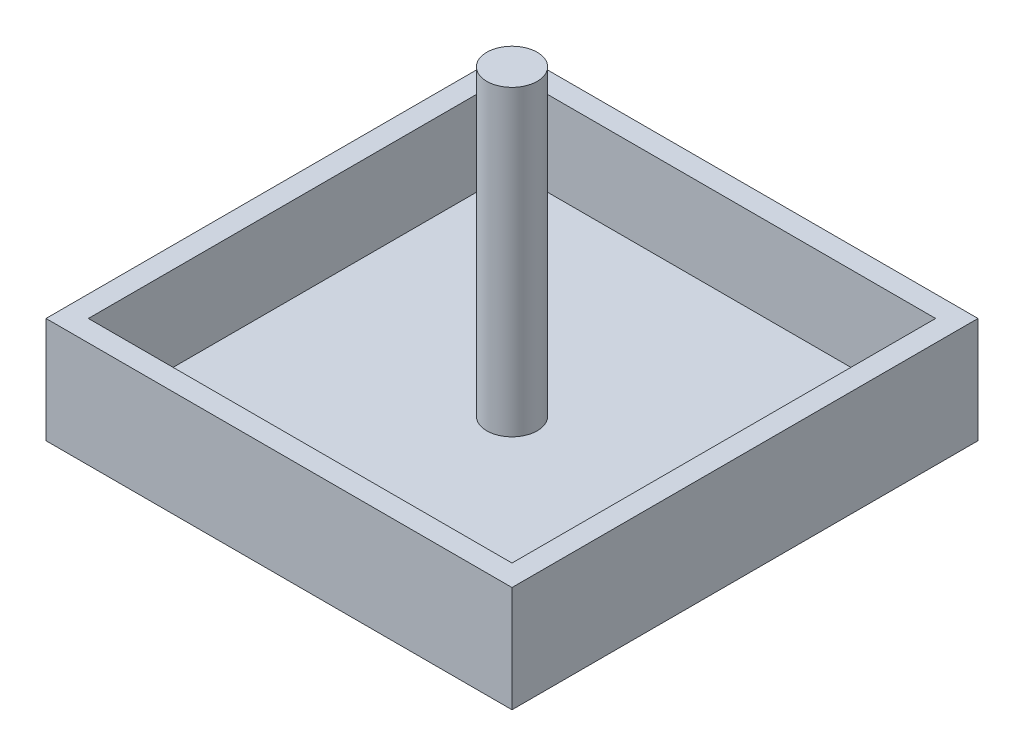
from build123d import *

# Parameters (mm, degrees)
ESBO_O1_W                = 40
ESBO_O1_H                = 40
RESSALTO_EXTRUS_O1_DEPTH = 2
ESBO_O2_W                = 40
ESBO_O2_H                = 40
RESSALTO_EXTRUS_O2_DEPTH = 10
ESBO_O3_R                = 2.38
RESSALTO_EXTRUS_O3_DEPTH = 28.58


with BuildPart() as part:
    # Esboço1 → Ressalto-extrusão1 (new body)
    with BuildSketch(Plane(origin=(0, 0, 0), x_dir=(1, 0, 0), z_dir=(0, 1, 0))):
        with Locations((-15.012062533, -15.012062533)):
            Rectangle(ESBO_O1_W, ESBO_O1_H)
    extrude(amount=RESSALTO_EXTRUS_O1_DEPTH)

    # Esboço2 → Ressalto-extrusão2 (add)
    with BuildSketch(Plane.XZ):
        Polygon((-37.012062533, 37.012062533), (-37.012062533, 35.012062533), (-37.012062533, -6.987937467), (-35.012062533, -6.987937467), (6.987937467, -6.987937467), (6.987937467, -4.987937467), (6.987937467, 37.012062533), (4.987937467, 37.012062533), align=None)
        with Locations((-15.012062533, 15.012062533)):
            Rectangle(ESBO_O2_W, ESBO_O2_H, mode=Mode.SUBTRACT)
    extrude(amount=-RESSALTO_EXTRUS_O2_DEPTH)

    # Esboço3 → Ressalto-extrusão3 (add)
    with BuildSketch(Plane(origin=(0, 2, 0), x_dir=(1, 0, 0), z_dir=(0, 1, 0))):
        with Locations(Location((-15.012062533, -15.012062533, 0), (0, 0, 270))):
            Circle(ESBO_O3_R)
    extrude(amount=RESSALTO_EXTRUS_O3_DEPTH)


solid = part.part
